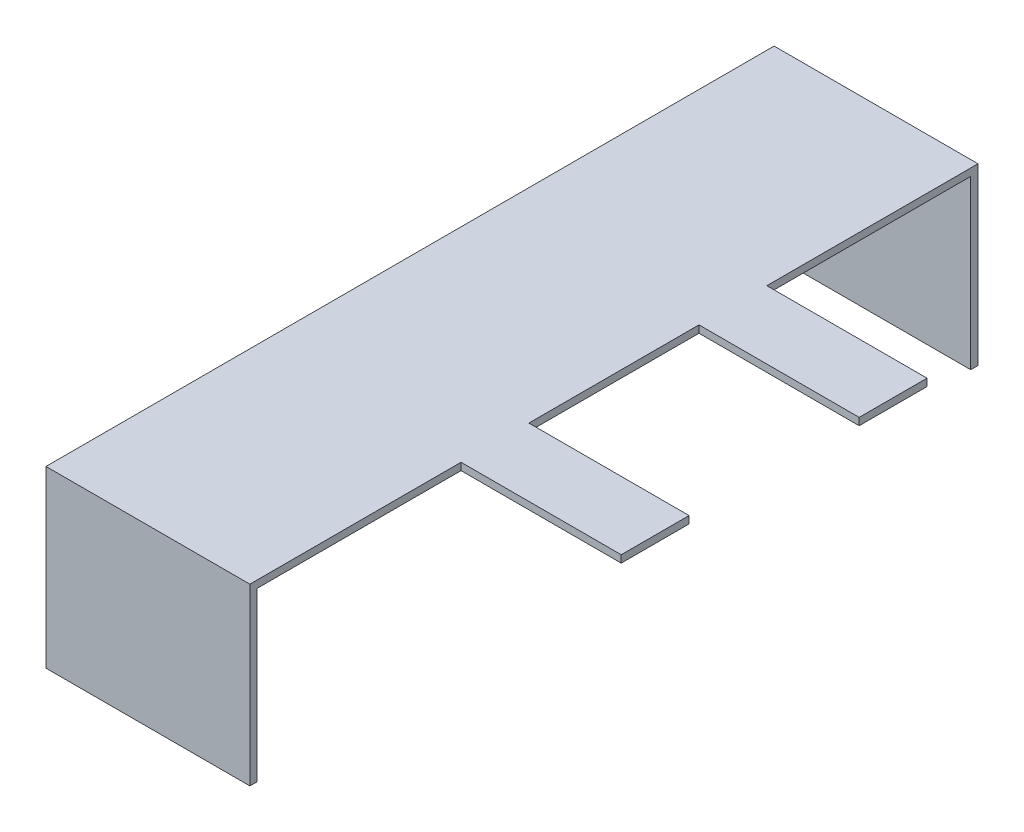
from build123d import *

# Parameters (mm, degrees)
SALIENTE_EXTRUIR1_DEPTH = 0.5
SALIENTE_EXTRUIR2_DEPTH = 14


with BuildPart() as part:
    # Croquis1 → Saliente-Extruir1 (new body)
    with BuildSketch(Plane(origin=(0, 0, 0), x_dir=(1, 0, 0), z_dir=(0, 1, 0))):
        Polygon((0, 0), (14, 0), (14, 14), (25, 14), (25, 18.66), (14, 18.66), (14, 30.34), (25, 30.34), (25, 35), (14, 35), (14, 49), (0, 49), align=None)
    extrude(amount=SALIENTE_EXTRUIR1_DEPTH)

    # Croquis2 → Saliente-Extruir2 (add, through all)
    with BuildSketch(Plane(origin=(14, 0, 0), x_dir=(0, 0, -1), z_dir=(1, 0, 0))):
        Polygon((0, 0.5), (-0.5, 0.5), (-0.5, -11.5), (0, -11.5), (0, 0), align=None)
        Polygon((49.5, 0.5), (49.5, -11.5), (49, -11.5), (49, 0), (49, 0.5), align=None)
    extrude(amount=-SALIENTE_EXTRUIR2_DEPTH)


solid = part.part
